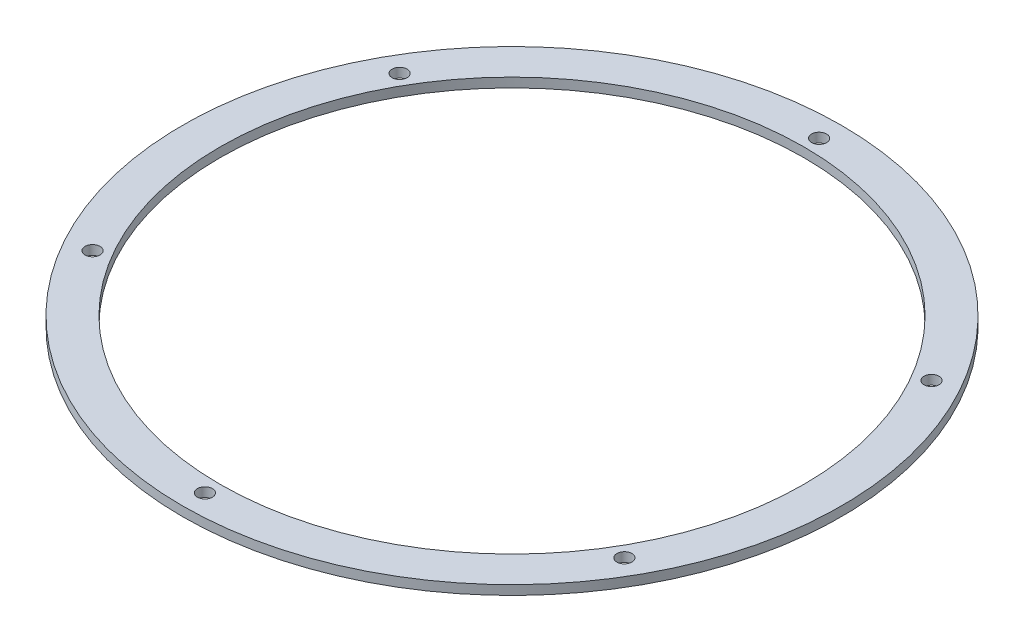
from build123d import *

# Parameters (mm, degrees)
SKETCH_1_R      = 88
SKETCH_1_R_2    = 2
SKETCH_1_R_3    = 78
EXTRUDE_1_DEPTH = 2.5


with BuildPart() as part:
    # 草图1 → 凸台-拉伸1 (new body)
    with BuildSketch(Plane(origin=(0, 0, 0), x_dir=(1, 0, 0), z_dir=(0, 1, 0))):
        with Locations(Location((0, 0, 0), (0, 0, 270))):
            Circle(SKETCH_1_R)
        with Locations(Location((0, 82, 0), (0, 0, 270))):
            Circle(SKETCH_1_R_2, mode=Mode.SUBTRACT)
        with Locations(Location((71.01408311, 41, 0), (0, 0, 270))):
            Circle(SKETCH_1_R_2, mode=Mode.SUBTRACT)
        with Locations(Location((71.01408311, -41, 0), (0, 0, 270))):
            Circle(SKETCH_1_R_2, mode=Mode.SUBTRACT)
        with Locations(Location((0, -82, 0), (0, 0, 270))):
            Circle(SKETCH_1_R_2, mode=Mode.SUBTRACT)
        with Locations(Location((-71.01408311, -41, 0), (0, 0, 270))):
            Circle(SKETCH_1_R_2, mode=Mode.SUBTRACT)
        with Locations(Location((-71.01408311, 41, 0), (0, 0, 270))):
            Circle(SKETCH_1_R_2, mode=Mode.SUBTRACT)
        with Locations(Location((0, 0, 0), (0, 0, 270))):
            Circle(SKETCH_1_R_3, mode=Mode.SUBTRACT)
    extrude(amount=EXTRUDE_1_DEPTH)


solid = part.part
